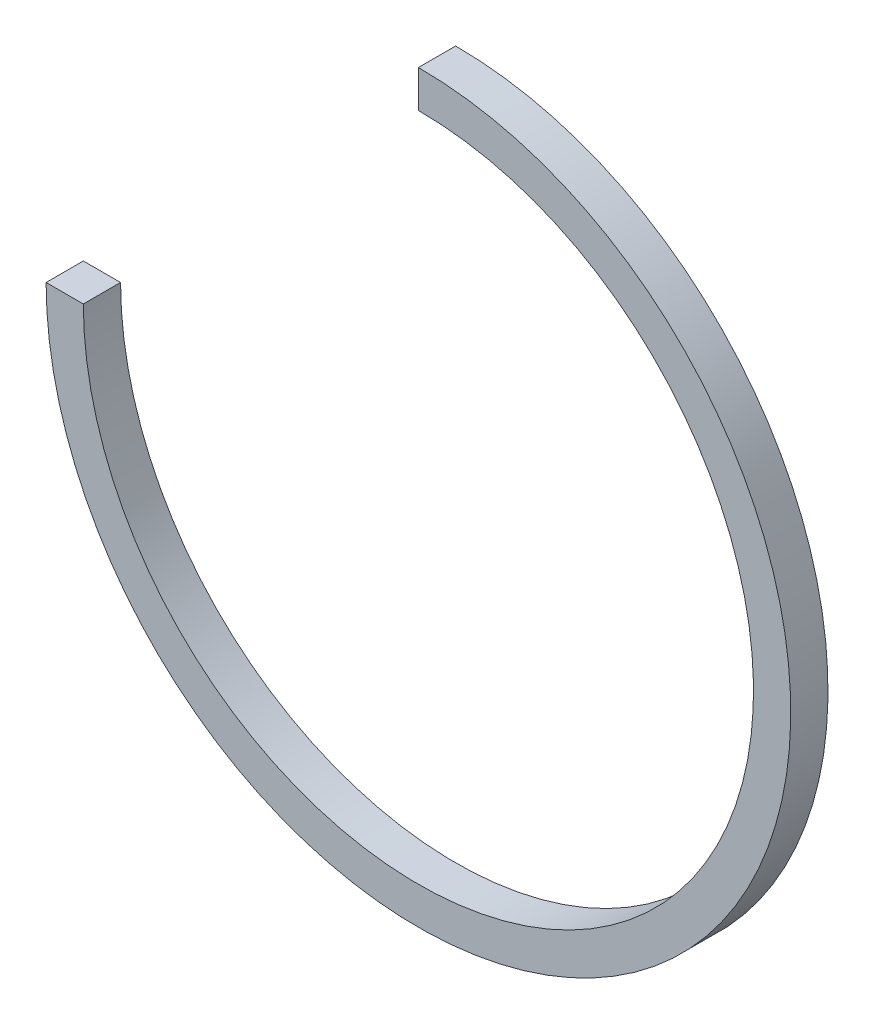
from build123d import *

# Parameters (mm, degrees)
EXTRUDE_1_DEPTH = 10


with BuildPart() as part:
    # 草图1 → 凸台-拉伸1 (new body)
    with BuildSketch(Plane.XY):
        with BuildLine():
            Line((-100, 0), (-90, 0))
            ThreePointArc((-90, 0), (63.639610307, -63.639610307), (0, 90))
            Line((0, 90), (0, 100))
            ThreePointArc((0, 100), (70.710678119, -70.710678119), (-100, 0))
        make_face()
    extrude(amount=EXTRUDE_1_DEPTH)


solid = part.part
